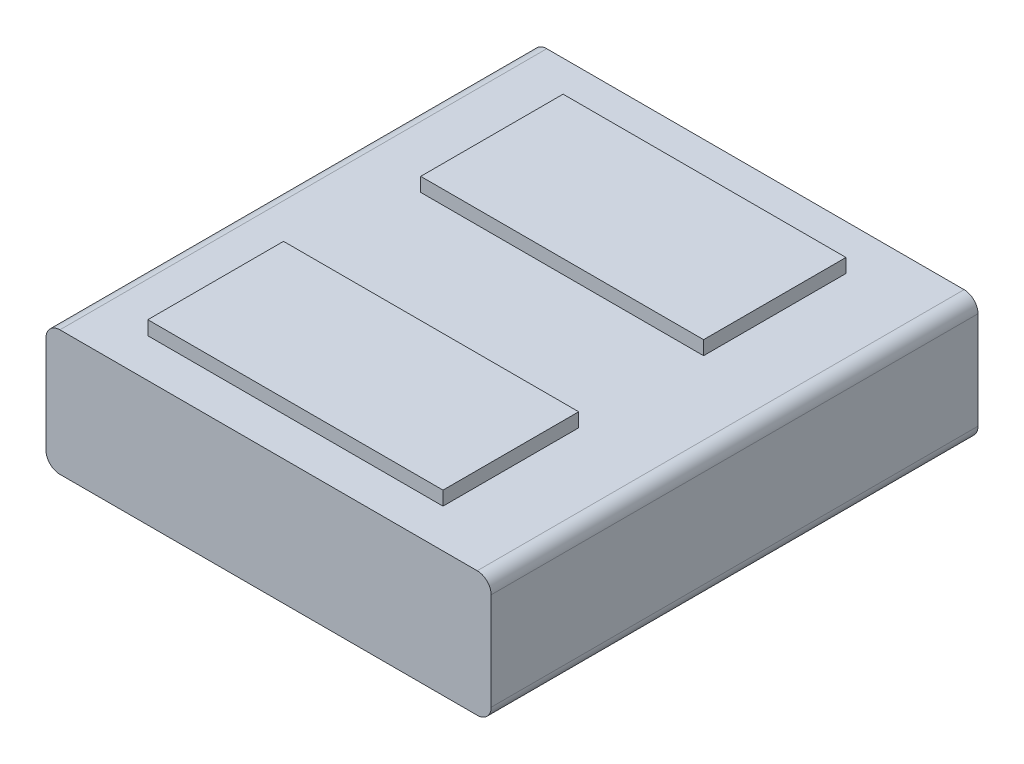
from build123d import *

# Parameters (mm, degrees)
SKETCH_1_W        = 64
SKETCH_1_H        = 18
EXTRUDE_1_DEPTH   = 70
FILLET_1_R        = 2
SKETCH_2_W        = 42.438172009
SKETCH_2_H        = 19.50989992
EXTRUDE_2_DEPTH   = 2
SKETCH_2_W_2      = 40.669439651
SKETCH_2_H_2      = 20.470186346
EXTRUDE_2_2_DEPTH = 2


with BuildPart() as part:
    # 草圖1 → 填料-伸長1 (new body)
    with BuildSketch(Plane.XY):
        with Locations((32, 9)):
            Rectangle(SKETCH_1_W, SKETCH_1_H)
    extrude(amount=EXTRUDE_1_DEPTH)

    # 圓角1
    fillet_1_edges = [part.edges().sort_by_distance(p)[0] for p in [
        (0, 18, 35),
        (64, 18, 35),
        (64, 0, 35),
        (0, 0, 35),
    ]]
    fillet(fillet_1_edges, radius=FILLET_1_R)


with BuildPart() as body_2:
    # 草圖2 → 填料-伸長2 (new body)
    with BuildSketch(Plane(origin=(0, 18, 0), x_dir=(1, 0, 0), z_dir=(0, 1, 0))):
        with Locations((30.280601754, -54.666211253)):
            Rectangle(SKETCH_2_W, SKETCH_2_H)
    extrude(amount=EXTRUDE_2_DEPTH)


with BuildPart() as body_3:
    # 草圖2 → Extrude 2 2 (new body)
    with BuildSketch(Plane(origin=(0, 18, 0), x_dir=(1, 0, 0), z_dir=(0, 1, 0))):
        with Locations((31.164967933, -16.72022809)):
            Rectangle(SKETCH_2_W_2, SKETCH_2_H_2)
    extrude(amount=EXTRUDE_2_2_DEPTH)


solid = Compound([part.part, body_2.part, body_3.part])
